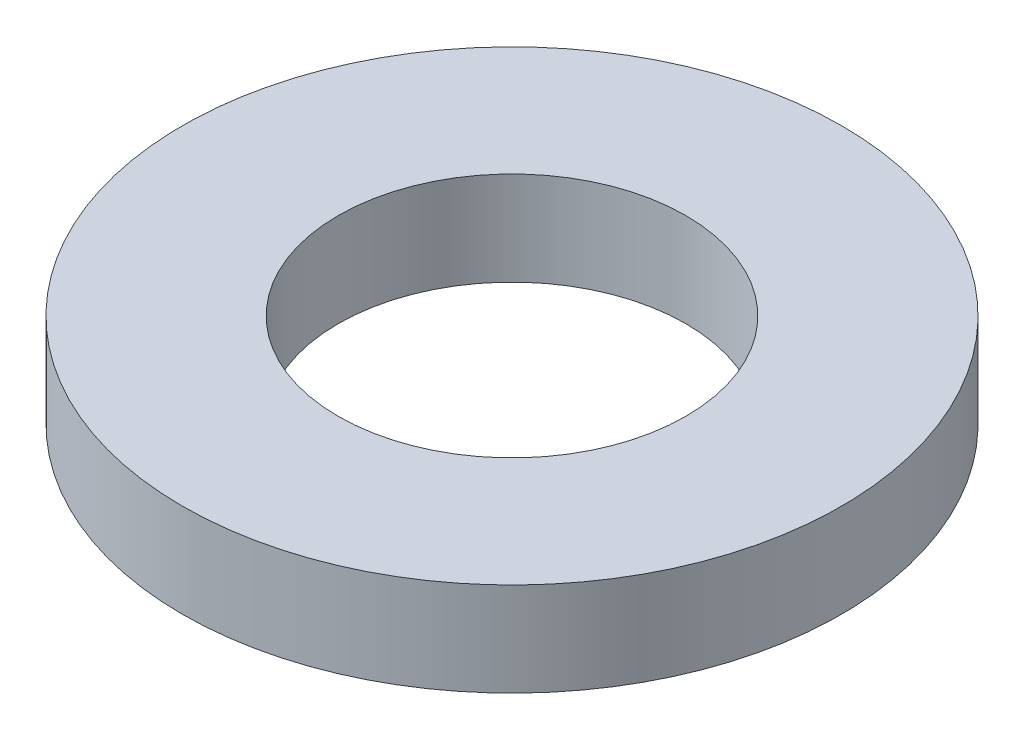
from build123d import *

# Parameters (mm, degrees)
SKETCH1_R           = 3.51875
BOSS_EXTRUDE1_DEPTH = 1
SKETCH2_R           = 1.85625
CUT_EXTRUDE1_DEPTH  = 6.075746558


with BuildPart() as part:
    # Sketch1 → Boss-Extrude1 (new body)
    with BuildSketch(Plane(origin=(0, 0, 0), x_dir=(1, 0, 0), z_dir=(0, 1, 0))):
        with Locations(Location((0, 0, 0), (0, 0, 270))):
            Circle(SKETCH1_R)
    extrude(amount=BOSS_EXTRUDE1_DEPTH)

    # Sketch2 → Cut-Extrude1 (cut, through all)
    with BuildSketch(Plane(origin=(0, 1, 0), x_dir=(1, 0, 0), z_dir=(0, 1, 0))):
        with Locations(Location((0, 0, 0), (0, 0, 270))):
            Circle(SKETCH2_R)
    extrude(amount=-CUT_EXTRUDE1_DEPTH, mode=Mode.SUBTRACT)


solid = part.part
